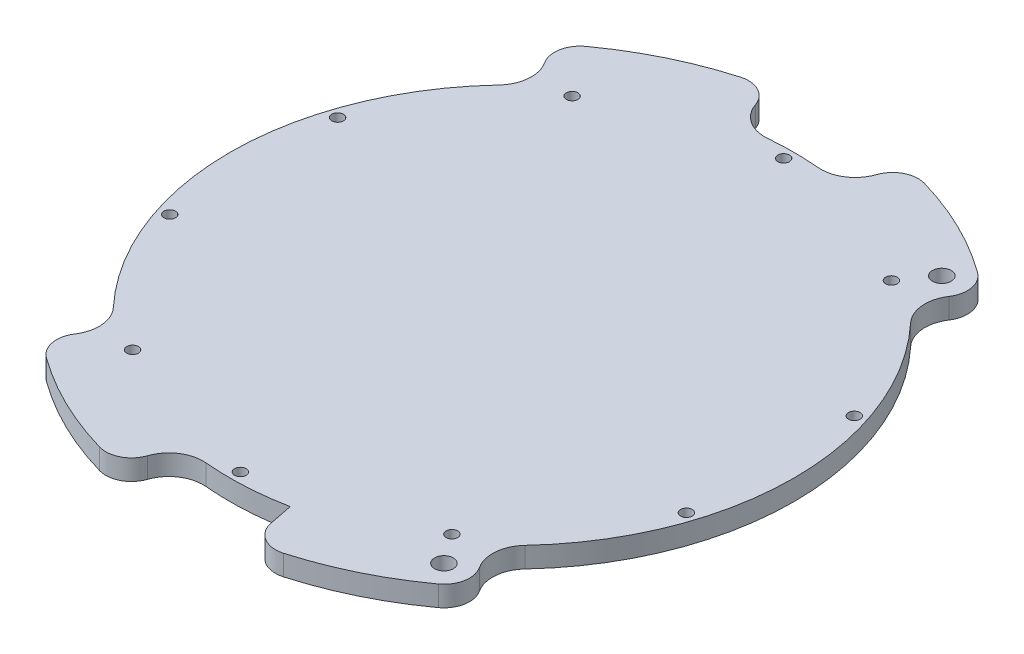
from build123d import *

# Parameters (mm, degrees)
SKETCH1_R            = 2.75
BOSS_EXTRUDE1_DEPTH  = 3
M3_CLEARANCE_HOLE1_D = 3.4
FILLET2_R            = 10


with BuildPart() as part:
    # Sketch1 → Boss-Extrude1 (new, symmetric)
    with BuildSketch(Plane(origin=(0, 0, 0), x_dir=(1, 0, 0), z_dir=(0, 1, 0))):
        with BuildLine():
            Line((-58.614111744, 67.959966353), (-53.914904373, 62.511483636))
            ThreePointArc((-53.914904373, 62.511483636), (-82.55, 0), (-53.914904373, -62.511483636))
            Line((-53.914904373, -62.511483636), (-58.614111744, -67.959966353))
            ThreePointArc((-58.614111744, -67.959966353), (-60.384815089, -73.721869234), (-57.34308106, -78.925980035))
            ThreePointArc((-57.34308106, -78.925980035), (-42.766558206, -87.684438581), (-26.890595122, -93.77864983))
            ThreePointArc((-26.890595122, -93.77864983), (-20.917021387, -92.971598421), (-17.46673379, -88.028883515))
            Line((-17.46673379, -88.028883515), (-16.066391761, -80.971436666))
            ThreePointArc((-16.066391761, -80.971436666), (0, -82.55), (16.066391761, -80.971436666))
            Line((16.066391761, -80.971436666), (17.46673379, -88.028883515))
            ThreePointArc((17.46673379, -88.028883515), (20.917021387, -92.971598421), (26.890595122, -93.77864983))
            ThreePointArc((26.890595122, -93.77864983), (42.766558206, -87.684438581), (57.34308106, -78.925980035))
            ThreePointArc((57.34308106, -78.925980035), (60.384815089, -73.721869234), (58.614111744, -67.959966353))
            Line((58.614111744, -67.959966353), (53.914904373, -62.511483636))
            ThreePointArc((53.914904373, -62.511483636), (82.55, 0), (53.914904373, 62.511483636))
            Line((53.914904373, 62.511483636), (58.614111744, 67.959966353))
            ThreePointArc((58.614111744, 67.959966353), (60.384815089, 73.721869234), (57.34308106, 78.925980035))
            ThreePointArc((57.34308106, 78.925980035), (42.766558206, 87.684438581), (26.890595122, 93.77864983))
            ThreePointArc((26.890595122, 93.77864983), (20.917021387, 92.971598421), (17.46673379, 88.028883515))
            Line((17.46673379, 88.028883515), (16.066391761, 80.971436666))
            ThreePointArc((16.066391761, 80.971436666), (0, 82.55), (-16.066391761, 80.971436666))
            Line((-16.066391761, 80.971436666), (-17.46673379, 88.028883515))
            ThreePointArc((-17.46673379, 88.028883515), (-20.917021387, 92.971598421), (-26.890595122, 93.77864983))
            ThreePointArc((-26.890595122, 93.77864983), (-42.766558206, 87.684438581), (-57.34308106, 78.925980035))
            ThreePointArc((-57.34308106, 78.925980035), (-60.384815089, 73.721869234), (-58.614111744, 67.959966353))
        make_face()
        with Locations(Location((52.934691668, -72.858352577, 0), (0, 0, 270))):
            Circle(SKETCH1_R, mode=Mode.SUBTRACT)
        with Locations(Location((52.934691668, 72.858352577, 0), (0, 0, 90))):
            Circle(SKETCH1_R, mode=Mode.SUBTRACT)
    extrude(amount=BOSS_EXTRUDE1_DEPTH, both=True)

    # M3 Clearance Hole1 (through all)
    with Locations(Plane(origin=(0, 3, 0), x_dir=(1, 0, 0), z_dir=(0, 1, 0))):
        with Locations((0, 79.5), (46.728927557, 64.316851053), (75.608993045, 24.566851053), (75.608993045, -24.566851053), (46.728927557, -64.316851053), (0, -79.5), (-46.728927557, -64.316851053), (-75.608993045, -24.566851053), (-75.608993045, 24.566851053), (-46.728927557, 64.316851053)):
            Hole(M3_CLEARANCE_HOLE1_D / 2)

    # Fillet2
    fillet2_edges = [part.edges().sort_by_distance(p)[0] for p in [
        (-53.914904373, 0, 62.511483636),
        (-53.914904373, 0, -62.511483636),
        (-16.066391761, 0, 80.971436666),
        (53.914904373, 0, 62.511483636),
        (53.914904373, 0, -62.511483636),
        (16.066391761, 0, -80.971436666),
        (-16.066391761, 0, -80.971436666),
    ]]
    fillet(fillet2_edges, radius=FILLET2_R)


solid = part.part
